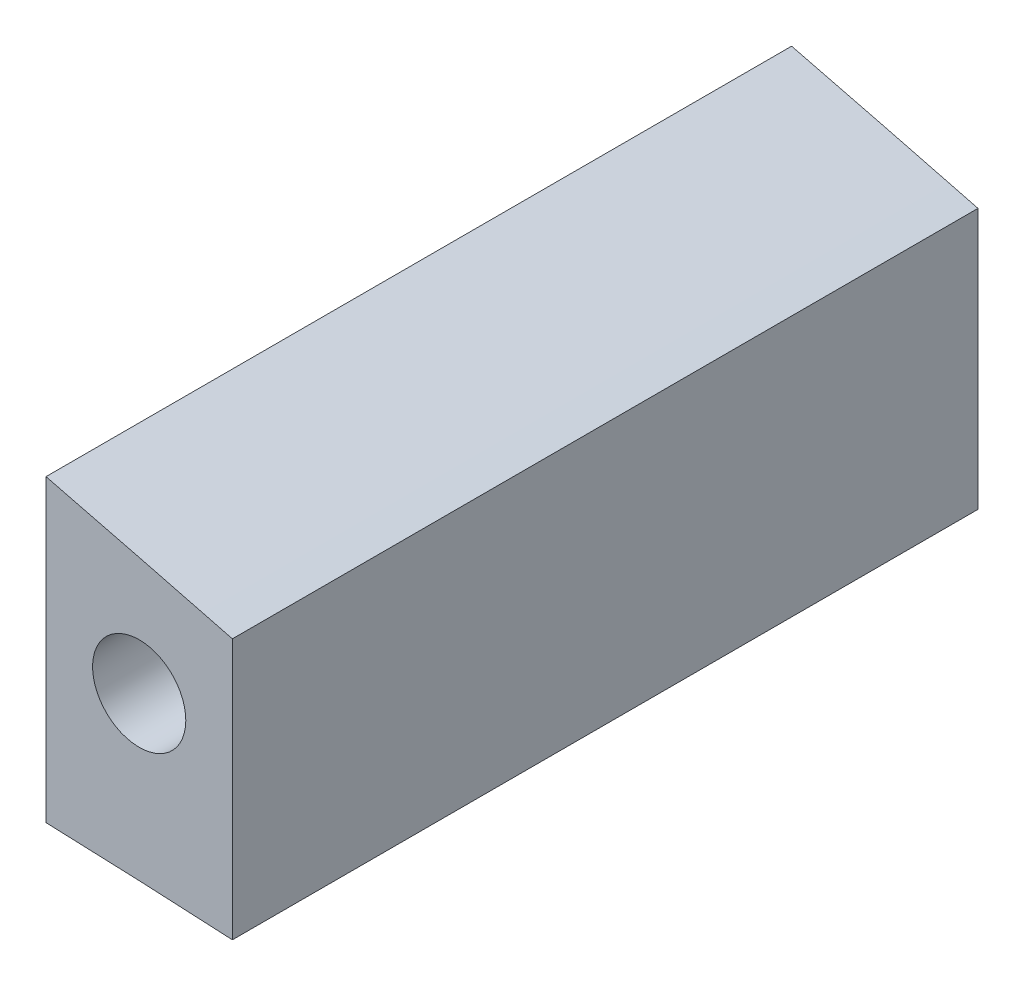
from build123d import *

# Parameters (mm, degrees)
BOSS_EXTRUDE1_DEPTH = 50.8
SKETCH2_R           = 6.35
SKETCH2_R_2         = 3.175
CUT_EXTRUDE1_DEPTH  = 320.788688435
SKETCH3_W           = 116.84
SKETCH3_H           = 50.8
CUT_EXTRUDE2_DEPTH  = 320.788688435
SKETCH4_W           = 250.150530068
SKETCH4_H           = 117.489254048
CUT_EXTRUDE3_DEPTH  = 244.924275514


with BuildPart() as part:
    # Sketch1 → Boss-Extrude1 (new body)
    with BuildSketch(Plane.XY):
        with BuildLine():
            add(Edge.make_bspline(
                [(0.000560351, 0.000130087), (0.810633127, 7.359196055), (8.649092025, 17.856605174), (26.286719818, 29.975176328), (52.111128271, 42.069215275), (89.597618475, 49.290763054), (131.400792109, 47.884831915), (173.256699242, 40.041104278), (217.961060472, 29.612974894), (256.952064401, 19.528920948), (290.35983767, 8.71099439), (301.273197721, 4.382828139), (314.816918223, -0.516206742), (309.846313895, 0.000130087)],
                knots=[0, 0, 0, 0, 0.060863618, 0.113688265, 0.188608742, 0.312908923, 0.448482434, 0.557612135, 0.691544113, 0.852438279, 0.92975597, 0.976058229, 1, 1, 1, 1], degree=3))
            add(Edge.make_bspline(
                [(309.846313895, 0.000130087), (303.956832565, 1.47095521), (293.989507544, 2.093987313), (276.26402299, 4.514356704), (260.846344817, 5.427413394), (235.858814759, 7.870306192), (205.101424636, 8.838080282), (157.718638092, 9.030650149), (110.497331172, 6.181495223), (66.506197185, -0.586669107), (36.454672816, -6.098499901), (15.316603331, -6.189065841), (1.230714189, -6.924076091), (0.000560351, 0.000130087)],
                knots=[0, 0, 0, 0, 0.057787081, 0.095274891, 0.171021118, 0.205339302, 0.335319146, 0.464904334, 0.658702312, 0.785511947, 0.893517288, 0.94309214, 1, 1, 1, 1], degree=3))
        make_face()
    extrude(amount=BOSS_EXTRUDE1_DEPTH)

    # Sketch2 → Cut-Extrude1 (cut, through all)
    with BuildSketch(Plane.XY.offset(50.8)):
        with Locations((20.32, 10.16)):
            Circle(SKETCH2_R)
        with Locations((227.296313895, 19.050130087)):
            Circle(SKETCH2_R_2)
    extrude(amount=-CUT_EXTRUDE1_DEPTH, mode=Mode.SUBTRACT)

    # Sketch3 → Cut-Extrude2 (cut, through all)
    with BuildSketch(Plane.XY.offset(50.8)):
        with Locations((292.066313895, 19.050130087)):
            Rectangle(SKETCH3_W, SKETCH3_H)
    extrude(amount=-CUT_EXTRUDE2_DEPTH, mode=Mode.SUBTRACT)

    # Sketch4 → Cut-Extrude3 (cut, through all)
    with BuildSketch(Plane.XY.offset(50.8)):
        with Locations((95.871048861, 34.528076629)):
            Rectangle(SKETCH4_W, SKETCH4_H)
    extrude(amount=-CUT_EXTRUDE3_DEPTH, mode=Mode.SUBTRACT)


solid = part.part
